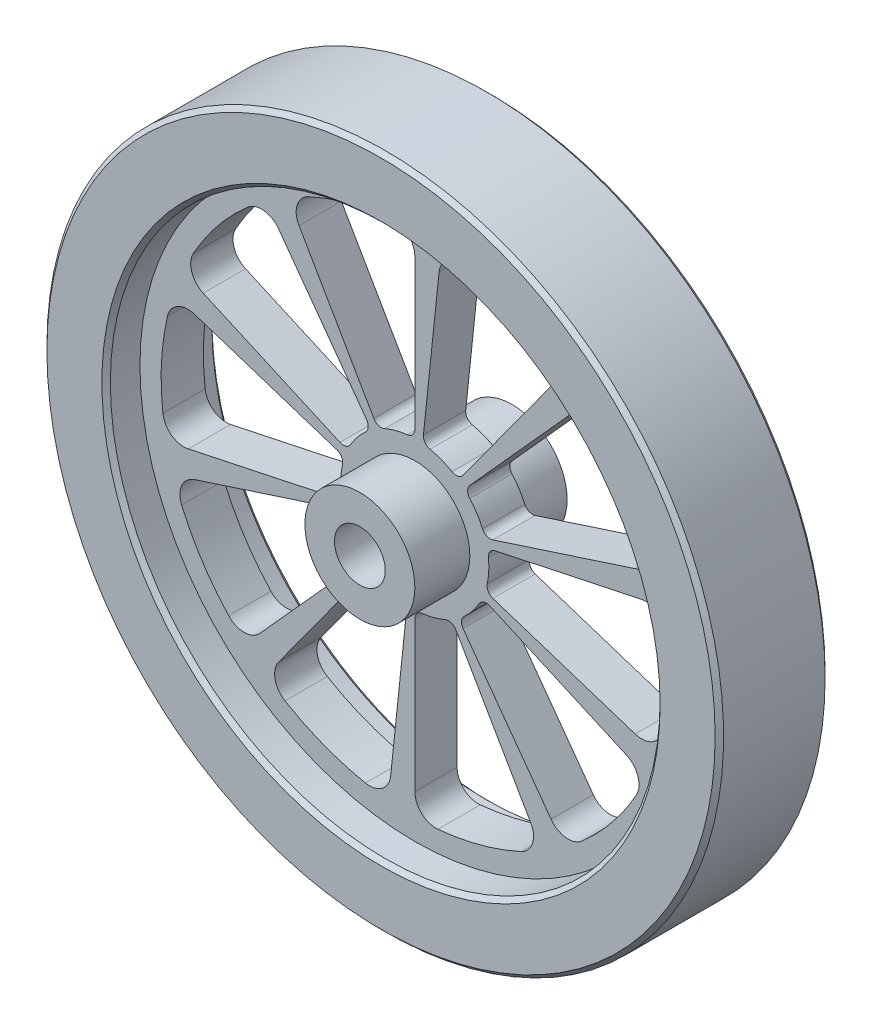
from build123d import *

# Parameters (mm, degrees)
SKETCH1_R           = 80
SKETCH1_R_2         = 6
BOSS_EXTRUDE1_DEPTH = 13
SKETCH2_R           = 65
CUT_EXTRUDE1_DEPTH  = 8
SKETCH3_R           = 13
SKETCH3_R_2         = 6
BOSS_EXTRUDE2_DEPTH = 18
CHAMFER1_SIZE       = 1
CUT_EXTRUDE2_DEPTH  = 116.451288429
CIRPATTERN1_COUNT   = 10


with BuildPart() as part:
    # Sketch1 → Boss-Extrude1 (new, symmetric)
    with BuildSketch(Plane.XY):
        with Locations(Location((0, 0, 0), (0, 0, 180))):
            Circle(SKETCH1_R)
        with Locations(Location((0, 0, 0), (0, 0, 180))):
            Circle(SKETCH1_R_2, mode=Mode.SUBTRACT)
    extrude(amount=BOSS_EXTRUDE1_DEPTH, both=True)

    # Sketch2 → Cut-Extrude1 (cut)
    with BuildSketch(Plane.XY.offset(13)):
        Circle(SKETCH2_R)
    cut_extrude1 = extrude(amount=-CUT_EXTRUDE1_DEPTH, mode=Mode.SUBTRACT)

    # Mirror1: Cut-Extrude1 across plane
    add(cut_extrude1.mirror(Plane.XY), mode=Mode.SUBTRACT)

    # Sketch3 → Boss-Extrude2 (add, symmetric)
    with BuildSketch(Plane.XY):
        with Locations(Location((0, 0, 0), (0, 0, 180))):
            Circle(SKETCH3_R)
        with Locations(Location((0, 0, 0), (0, 0, 180))):
            Circle(SKETCH3_R_2, mode=Mode.SUBTRACT)
    extrude(amount=BOSS_EXTRUDE2_DEPTH, both=True)

    # Chamfer1
    chamfer1_edges = [part.edges().sort_by_distance(p)[0] for p in [
        (-65, 0, 13),
        (-65, 0, -13),
        (80, 0, -13),
        (80, 0, 13),
    ]]
    chamfer(chamfer1_edges, length=CHAMFER1_SIZE)

    # Sketch7 → Cut-Extrude2 (cut, through all)
    with BuildSketch(Plane.XY.offset(5)):
        with BuildLine():
            Line((0, 54.772255751), (0, 19.397164741))
            ThreePointArc((0, 19.397164741), (-0.515032591, 18.057436487), (-1.794871795, 17.407711947))
            ThreePointArc((-1.794871795, 17.407711947), (-4.529333289, 16.90370196), (-7.149451403, 15.972956666))
            ThreePointArc((-7.149451403, 15.972956666), (-8.582686936, 15.895715021), (-9.698582371, 16.798437427))
            Line((-9.698582371, 16.798437427), (-27.386127875, 47.434164903))
            ThreePointArc((-27.386127875, 47.434164903), (-27.821744262, 51.446675992), (-25.152000934, 54.473634439))
            ThreePointArc((-25.152000934, 54.473634439), (-15.529142706, 57.955549577), (-5.454545455, 59.751551728))
            ThreePointArc((-5.454545455, 59.751551728), (-1.629000688, 58.46500048), (0, 54.772255751))
        make_face()
    cut_extrude2 = extrude(amount=-CUT_EXTRUDE2_DEPTH, mode=Mode.SUBTRACT)

    # CirPattern1: Cut-Extrude2 ×10 about axis
    cirpattern1_axis = Axis((0, 0, 0), (0, 0, 1))
    for i in range(1, CIRPATTERN1_COUNT):
        add(cut_extrude2.rotate(cirpattern1_axis, i * 360 / CIRPATTERN1_COUNT), mode=Mode.SUBTRACT)


solid = part.part
